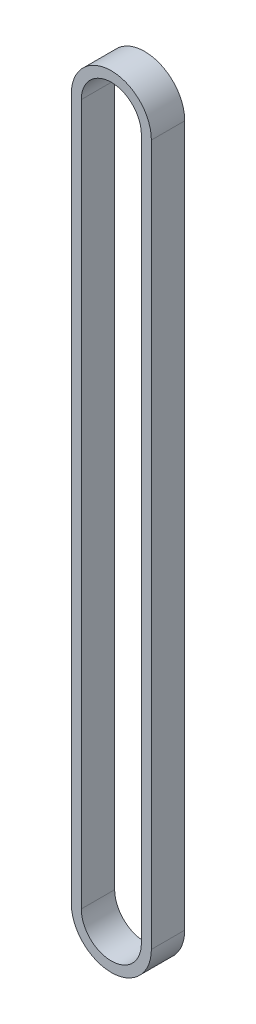
from build123d import *

# Parameters (mm, degrees)
EXTRUDE_1_DEPTH = 10


with BuildPart() as part:
    # 草图1 → 凸台-拉伸1 (new body)
    with BuildSketch(Plane.XY):
        with BuildLine():
            Line((12, 0), (12, -210))
            ThreePointArc((12, -210), (0, -222), (-12, -210))
            Line((-12, -210), (-12, 0))
            ThreePointArc((-12, 0), (0, 12), (12, 0))
        make_face()
        with BuildLine():
            Line((9, 0), (9, -210))
            ThreePointArc((9, -210), (0, -219), (-9, -210))
            Line((-9, -210), (-9, 0))
            ThreePointArc((-9, 0), (0, 9), (9, 0))
        make_face(mode=Mode.SUBTRACT)
    extrude(amount=EXTRUDE_1_DEPTH)


solid = part.part
